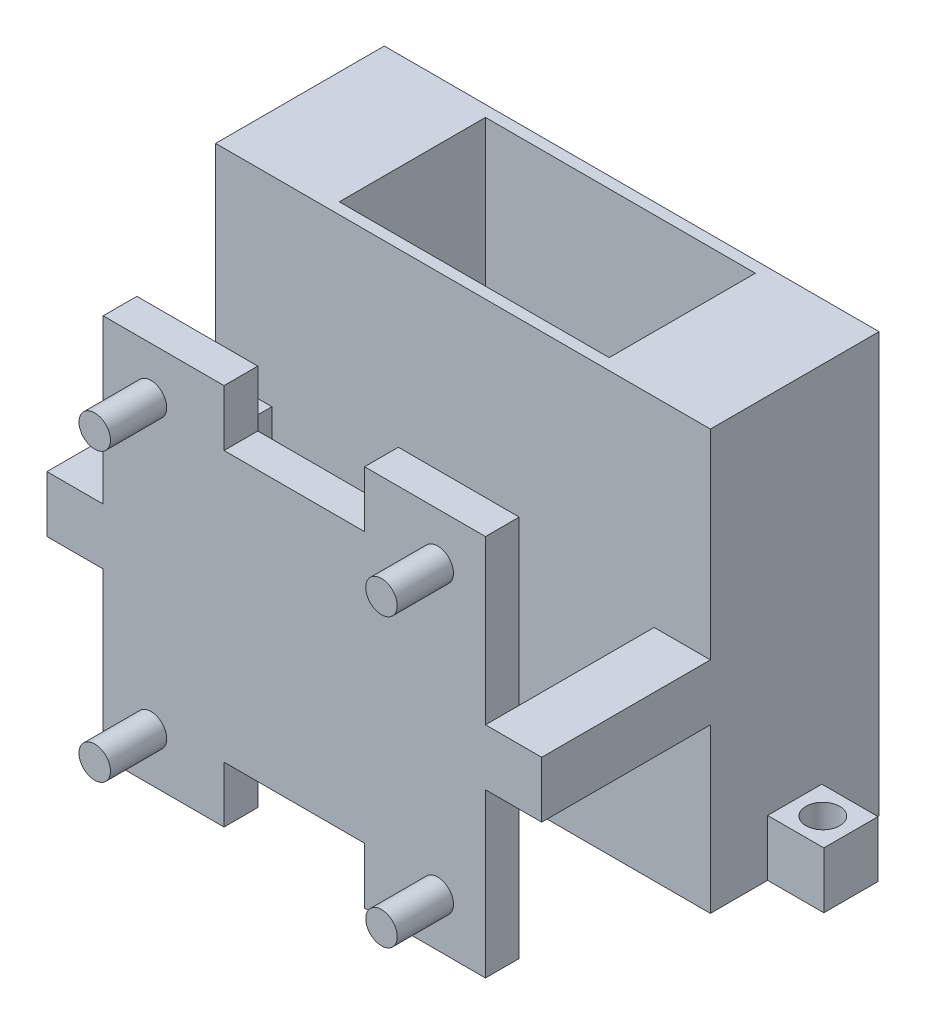
from build123d import *

# Parameters (mm, degrees)
SKETCH1_W           = 34
SKETCH1_H           = 34
BOSS_EXTRUDE1_DEPTH = 3
SKETCH2_W           = 12.5
SKETCH2_H           = 5
CUT_EXTRUDE1_DEPTH  = 49.176757882
BOSS_EXTRUDE2_DEPTH = 5
SKETCH3_R           = 1.4
BOSS_EXTRUDE3_DEPTH = 8
SKETCH33_W          = 15
SKETCH33_H          = 5
BOSS_EXTRUDE4_DEPTH = 5
BOSS_EXTRUDE6_DEPTH = 15
SKETCH36_W          = 24
SKETCH36_H          = 13
CUT_EXTRUDE2_DEPTH  = 19.5
BOSS_EXTRUDE7_DEPTH = 5
SKETCH39_R          = 1.5
CUT_EXTRUDE3_DEPTH  = 61.897668661


with BuildPart() as part:
    # Sketch1 → Boss-Extrude1 (new body)
    with BuildSketch(Plane.XY):
        with Locations((17, -17)):
            Rectangle(SKETCH1_W, SKETCH1_H)
    extrude(amount=BOSS_EXTRUDE1_DEPTH)

    # Sketch2 → Cut-Extrude1 (cut, through all)
    with BuildSketch(Plane(origin=(0, 0, 0), x_dir=(-1, 0, 0), z_dir=(0, 0, -1))):
        with Locations((-17, -2.5)):
            Rectangle(SKETCH2_W, SKETCH2_H)
        with Locations((-17, -31.5)):
            Rectangle(SKETCH2_W, SKETCH2_H)
    extrude(amount=-CUT_EXTRUDE1_DEPTH, mode=Mode.SUBTRACT)

    # Sketch25 → Boss-Extrude2 (add)
    with BuildSketch(Plane(origin=(34, 0, 0), x_dir=(0, 0, -1), z_dir=(1, 0, 0))):
        Polygon((-3, -17), (-3, -14.5), (12, -14.5), (12, -19.5), (-3, -19.5), align=None)
    extrude(amount=BOSS_EXTRUDE2_DEPTH)

    # Sketch3 → Boss-Extrude3 (add)
    with BuildSketch(Plane(origin=(0, 0, 0), x_dir=(-1, 0, 0), z_dir=(0, 0, -1))):
        with Locations((-29.75, -4.25)):
            Circle(SKETCH3_R)
        with Locations(Location((-4.25, -4.25, 0), (0, 0, 180))):
            Circle(SKETCH3_R)
        with Locations((-4.25, -29.75)):
            Circle(SKETCH3_R)
        with Locations(Location((-29.75, -29.75, 0), (0, 0, 180))):
            Circle(SKETCH3_R)
    extrude(amount=-BOSS_EXTRUDE3_DEPTH)

    # Sketch33 → Boss-Extrude4 (add)
    with BuildSketch(Plane.ZY):
        with Locations((-4.5, -17)):
            Rectangle(SKETCH33_W, SKETCH33_H)
    extrude(amount=BOSS_EXTRUDE4_DEPTH)

    # Sketch35 → Boss-Extrude6 (add)
    with BuildSketch(Plane(origin=(0, 0, -12), x_dir=(-1, 0, 0), z_dir=(0, 0, -1))):
        Polygon((-39, -17), (-39, 3.277699473), (5, 3.277699473), (5, -17), (5, -34.025954319), (-39, -34.025954319), align=None)
    extrude(amount=BOSS_EXTRUDE6_DEPTH)

    # Sketch36 → Cut-Extrude2 (cut)
    with BuildSketch(Plane(origin=(0, 3.277699473, 0), x_dir=(1, 0, 0), z_dir=(0, 1, 0))):
        with Locations((17, 19.5)):
            Rectangle(SKETCH36_W, SKETCH36_H)
    extrude(amount=-CUT_EXTRUDE2_DEPTH, mode=Mode.SUBTRACT)

    # Sketch38 → Boss-Extrude7 (add)
    with BuildSketch(Plane(origin=(0, -34.025954319, 0), x_dir=(-1, 0, 0), z_dir=(0, -1, 0))):
        Polygon((10, 21.910063987), (5, 21.910063987), (5, 17.089936013), (10, 17.089936013), (10, 19.410063987), (10, 19.589936013), align=None)
        Polygon((-39, 17.089936013), (-39, 21.910063987), (-44, 21.910063987), (-44, 19.589936013), (-44, 19.410063987), (-44, 17.089936013), align=None)
    extrude(amount=-BOSS_EXTRUDE7_DEPTH)

    # Sketch39 → Cut-Extrude3 (cut, through all)
    with BuildSketch(Plane(origin=(0, -29.025954319, 0), x_dir=(1, 0, 0), z_dir=(0, 1, 0))):
        with Locations(Location((-7.5, 19.5, 0), (0, 0, 270))):
            Circle(SKETCH39_R)
        with Locations(Location((41.5, 19.5, 0), (0, 0, 270))):
            Circle(SKETCH39_R)
    extrude(amount=-CUT_EXTRUDE3_DEPTH, mode=Mode.SUBTRACT)


solid = part.part
